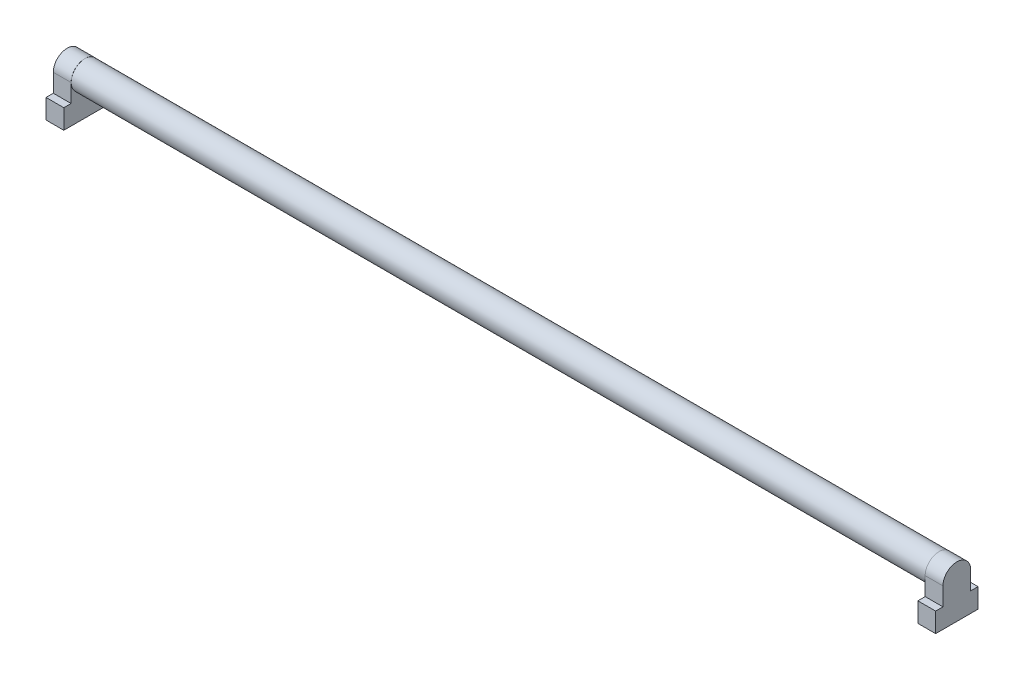
from build123d import *

# Parameters (mm, degrees)
SKETCH1_R           = 7.75
BOSS_EXTRUDE1_DEPTH = 240
BOSS_EXTRUDE2_DEPTH = 10


with BuildPart() as part:
    # Sketch1 → Boss-Extrude1 (new body)
    with BuildSketch(Plane(origin=(0, 0, 0), x_dir=(0, 0, -1), z_dir=(1, 0, 0))):
        Circle(SKETCH1_R)
    boss_extrude1 = extrude(amount=BOSS_EXTRUDE1_DEPTH)

    # Sketch2 → Boss-Extrude2 (add)
    with BuildSketch(Plane(origin=(240, 0, 0), x_dir=(0, 0, -1), z_dir=(1, 0, 0))):
        with BuildLine():
            Line((-7.8, 0), (-7.8, -10.2))
            Line((-7.8, -10.2), (-11.9, -10.2))
            Line((-11.9, -10.2), (-11.9, -21.2))
            Line((-11.9, -21.2), (11.9, -21.2))
            Line((11.9, -21.2), (11.9, -10.2))
            Line((11.9, -10.2), (7.8, -10.2))
            Line((7.8, -10.2), (7.8, 0))
            ThreePointArc((7.8, 0), (0, 7.8), (-7.8, 0))
        make_face()
    boss_extrude2 = extrude(amount=BOSS_EXTRUDE2_DEPTH)

    # Mirror1: Boss-Extrude1, Boss-Extrude2 across plane
    add(boss_extrude1.mirror(Plane.ZY))
    add(boss_extrude2.mirror(Plane.ZY))


solid = part.part
